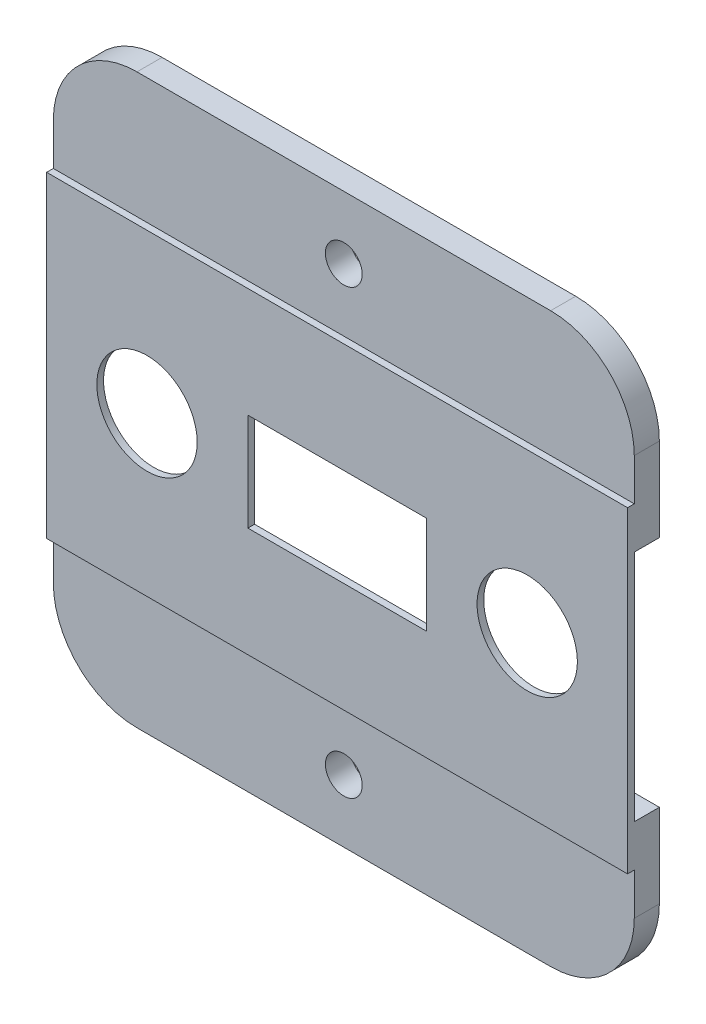
from build123d import *

# Parameters (mm, degrees)
BOSS_EXTRUDE1_DEPTH   = 1.905
BOSS_EXTRUDE1_2_DEPTH = 1.905
SKETCH2_W             = 44.1071
SKETCH2_H             = 24.0792
SKETCH2_R             = 3.81
BOSS_EXTRUDE2_DEPTH   = 0.508
F_3_CLEARANCE_HOLE1_D = 2.794


with BuildPart() as part:
    # Sketch1 → Boss-Extrude1 (new body)
    with BuildSketch(Plane.XY):
        with BuildLine():
            Line((-26.756249968, -18.6229), (-26.756249968, -12.2729))
            ThreePointArc((-26.756249968, -12.2729), (-24.896378028, -7.782771939), (-20.406249968, -5.9229))
            Line((-20.406249968, -5.9229), (11.000850032, -5.9229))
            ThreePointArc((11.000850032, -5.9229), (15.490978093, -7.782771939), (17.350850032, -12.2729))
            Line((17.350850032, -12.2729), (17.350850032, -18.6229))
            Line((17.350850032, -18.6229), (-26.756249968, -18.6229))
        make_face()
    extrude(amount=BOSS_EXTRUDE1_DEPTH)



with BuildPart() as body_2:
    # Sketch1 → Boss-Extrude1 2 (new body)
    with BuildSketch(Plane.XY):
        with BuildLine():
            Line((-26.756249968, -36.3521), (17.350850032, -36.3521))
            Line((17.350850032, -36.3521), (17.350850032, -42.7021))
            ThreePointArc((17.350850032, -42.7021), (15.490978093, -47.192228061), (11.000850032, -49.0521))
            Line((11.000850032, -49.0521), (-20.406249968, -49.0521))
            ThreePointArc((-20.406249968, -49.0521), (-24.896378028, -47.192228061), (-26.756249968, -42.7021))
            Line((-26.756249968, -42.7021), (-26.756249968, -36.3521))
        make_face()
    extrude(amount=BOSS_EXTRUDE1_2_DEPTH)


with BuildPart() as part_1:
    add(part.part)

    add(body_2.part)  # Boss-Extrude2 merges body 2
    # Sketch2 → Boss-Extrude2 (add)
    with BuildSketch(Plane.XY.offset(1.905)):
        with Locations((-4.702699968, -27.4875)):
            Rectangle(SKETCH2_W, SKETCH2_H)
        with Locations((9.730850032, -27.4875)):
            Circle(SKETCH2_R, mode=Mode.SUBTRACT)
        with Locations((-19.136249968, -27.4875)):
            Circle(SKETCH2_R, mode=Mode.SUBTRACT)
        Polygon((-11.478149968, -23.77275), (-11.478149968, -24.71255), (-11.478149968, -30.26245), (-11.478149968, -31.20225), (2.072750032, -31.20225), (2.072750032, -23.77275), align=None, mode=Mode.SUBTRACT)
    extrude(amount=BOSS_EXTRUDE2_DEPTH)

    # #3 Clearance Hole1 (through all)
    with Locations(Plane.XY.offset(1.905)):
        with Locations((-4.702699968, -10.6854), (-4.702699968, -44.2896)):
            Hole(F_3_CLEARANCE_HOLE1_D / 2)


solid = part_1.part
